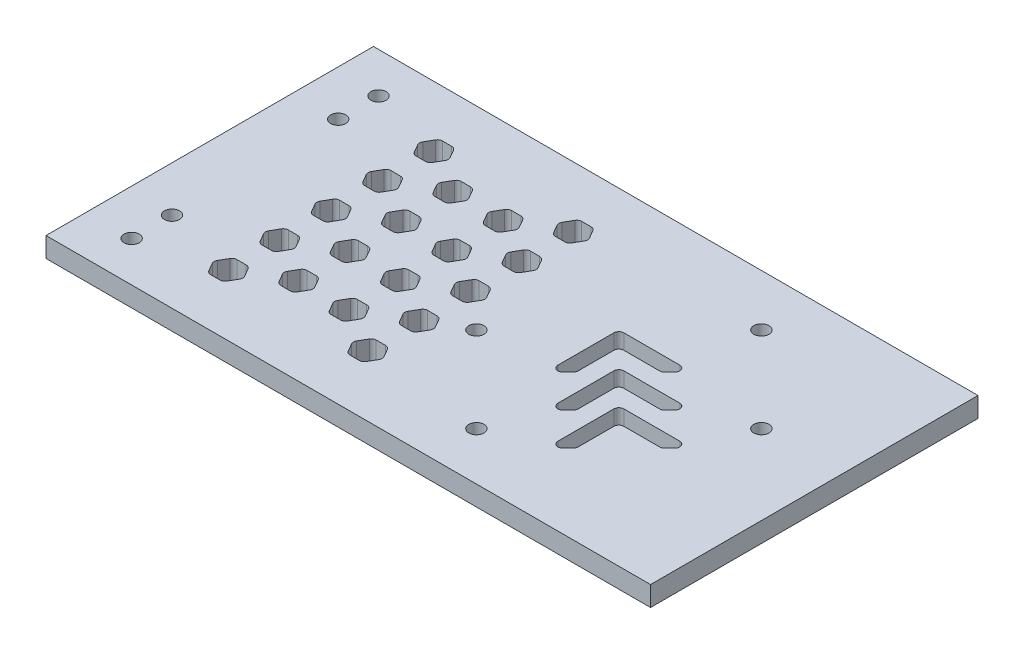
from build123d import *

# Parameters (mm, degrees)
SKETCH_1_W          = 120
SKETCH_1_H          = 65
EXTRUDE_1_DEPTH     = 3.95
SKETCH_4_R          = 1.5
SKETCH_4_R_2        = 1.499999999
CUT_EXTRUDE_1_DEPTH = 4
CUT_EXTRUDE_2_DEPTH = 8
SKETCH_7_R          = 1.5
CUT_EXTRUDE_3_DEPTH = 8
CUT_EXTRUDE_4_DEPTH = 10
FILLET_1_R          = 1


with BuildPart() as part:
    # 草图1 → 凸台-拉伸1 (new body)
    with BuildSketch(Plane(origin=(0, 0, 0), x_dir=(1, 0, 0), z_dir=(0, 1, 0))):
        Rectangle(SKETCH_1_W, SKETCH_1_H)
    extrude(amount=EXTRUDE_1_DEPTH)

    # 草图4 → 切除-拉伸1 (cut)
    with BuildSketch(Plane(origin=(0, 3.95, 0), x_dir=(1, 0, 0), z_dir=(0, 1, 0))):
        with Locations(Location((-1.054245082, -6.016822731, 0), (0, 0, 270))):
            Circle(SKETCH_4_R)
        with Locations(Location((27.230026166, 22.267448517, 0), (0, 0, 270))):
            Circle(SKETCH_4_R)
        with Locations(Location((15.916317667, -22.987385479, 0), (0, 0, 270))):
            Circle(SKETCH_4_R)
        with Locations(Location((44.200588915, 5.296885768, 0), (0, 0, 270))):
            Circle(SKETCH_4_R_2)
    extrude(amount=-CUT_EXTRUDE_1_DEPTH, mode=Mode.SUBTRACT)

    # 草图5 → 切除-拉伸2 (cut)
    with BuildSketch(Plane(origin=(0, 3.95, 0), x_dir=(1, 0, 0), z_dir=(0, 1, 0))):
        Polygon((13.087890542, 8.125312893), (13.087890542, -6.374687107), (16.087890542, -3.374687107), (16.087890542, 5.125312893), (24.587890542, 5.125312893), (27.587890542, 8.125312893), align=None)
        Polygon((34.123424448, 1.589778987), (19.623424448, 1.589778987), (19.623424448, -12.910221013), (22.623424448, -9.910221013), (22.623424448, -1.410221013), (31.123424448, -1.410221013), align=None)
        Polygon((40.658958354, -4.945754919), (26.158958354, -4.945754919), (26.158958354, -19.445754919), (29.158958354, -16.445754919), (29.158958354, -7.945754919), (37.658958354, -7.945754919), align=None)
    extrude(amount=-CUT_EXTRUDE_2_DEPTH, mode=Mode.SUBTRACT)

    # 草图7 → 切除-拉伸3 (cut)
    with BuildSketch(Plane(origin=(0, 3.95, 0), x_dir=(1, 0, 0), z_dir=(0, 1, 0))):
        with Locations(Location((-51, -24.5, 0), (0, 0, 270))):
            Circle(SKETCH_7_R)
        with Locations(Location((-51, -16.5, 0), (0, 0, 270))):
            Circle(SKETCH_7_R)
        with Locations(Location((-51, 24.5, 0), (0, 0, 270))):
            Circle(SKETCH_7_R)
        with Locations(Location((-51, 16.5, 0), (0, 0, 270))):
            Circle(SKETCH_7_R)
    extrude(amount=-CUT_EXTRUDE_3_DEPTH, mode=Mode.SUBTRACT)

    # 草图9 → 切除-拉伸4 (cut)
    with BuildSketch(Plane(origin=(0, 3.95, 0), x_dir=(1, 0, 0), z_dir=(0, 1, 0))):
        Polygon((-34.5, 17.901923789), (-33, 20.5), (-34.5, 23.098076211), (-37.5, 23.098076211), (-39, 20.5), (-37.5, 17.901923789), align=None)
        Polygon((-34.5, 7.705771366), (-33, 10.303847577), (-34.5, 12.901923789), (-37.5, 12.901923789), (-39, 10.303847577), (-37.5, 7.705771366), align=None)
        Polygon((-34.5, -2.490381057), (-33, 0.107695155), (-34.5, 2.705771366), (-37.5, 2.705771366), (-39, 0.107695155), (-37.5, -2.490381057), align=None)
        Polygon((-34.5, -12.686533479), (-33, -10.088457268), (-34.5, -7.490381057), (-37.5, -7.490381057), (-39, -10.088457268), (-37.5, -12.686533479), align=None)
        Polygon((-34.5, -22.882685902), (-33, -20.284609691), (-34.5, -17.686533479), (-37.5, -17.686533479), (-39, -20.284609691), (-37.5, -22.882685902), align=None)
        Polygon((-24.169872981, 15.401923789), (-25.669872981, 18), (-28.669872981, 18), (-30.169872981, 15.401923789), (-28.669872981, 12.803847577), (-25.669872981, 12.803847577), align=None)
        Polygon((-24.169872981, 5.205771366), (-25.669872981, 7.803847577), (-28.669872981, 7.803847577), (-30.169872981, 5.205771366), (-28.669872981, 2.607695155), (-25.669872981, 2.607695155), align=None)
        Polygon((-24.169872981, -4.990381057), (-25.669872981, -2.392304845), (-28.669872981, -2.392304845), (-30.169872981, -4.990381057), (-28.669872981, -7.588457268), (-25.669872981, -7.588457268), align=None)
        Polygon((-24.169872981, -15.186533479), (-25.669872981, -12.588457268), (-28.669872981, -12.588457268), (-30.169872981, -15.186533479), (-28.669872981, -17.784609691), (-25.669872981, -17.784609691), align=None)
        Polygon((-18.669872981, -17.784609691), (-20.169872981, -15.186533479), (-18.669872981, -12.588457268), (-15.669872981, -12.588457268), (-14.169872981, -15.186533479), (-15.669872981, -17.784609691), align=None)
        Polygon((-18.669872981, -7.588457268), (-20.169872981, -4.990381057), (-18.669872981, -2.392304845), (-15.669872981, -2.392304845), (-14.169872981, -4.990381057), (-15.669872981, -7.588457268), align=None)
        Polygon((-18.669872981, 2.607695155), (-20.169872981, 5.205771366), (-18.669872981, 7.803847577), (-15.669872981, 7.803847577), (-14.169872981, 5.205771366), (-15.669872981, 2.607695155), align=None)
        Polygon((-18.669872981, 12.803847577), (-20.169872981, 15.401923789), (-18.669872981, 18), (-15.669872981, 18), (-14.169872981, 15.401923789), (-15.669872981, 12.803847577), align=None)
        Polygon((-6.839745962, -22.882685902), (-9.839745962, -22.882685902), (-11.339745962, -20.284609691), (-9.839745962, -17.686533479), (-6.839745962, -17.686533479), (-5.339745962, -20.284609691), align=None)
        Polygon((-6.839745962, -12.686533479), (-9.839745962, -12.686533479), (-11.339745962, -10.088457268), (-9.839745962, -7.490381057), (-6.839745962, -7.490381057), (-5.339745962, -10.088457268), align=None)
        Polygon((-6.839745962, -2.490381057), (-9.839745962, -2.490381057), (-11.339745962, 0.107695155), (-9.839745962, 2.705771366), (-6.839745962, 2.705771366), (-5.339745962, 0.107695155), align=None)
        Polygon((-6.839745962, 7.705771366), (-9.839745962, 7.705771366), (-11.339745962, 10.303847577), (-9.839745962, 12.901923789), (-6.839745962, 12.901923789), (-5.339745962, 10.303847577), align=None)
        Polygon((-6.839745962, 17.901923789), (-9.839745962, 17.901923789), (-11.339745962, 20.5), (-9.839745962, 23.098076211), (-6.839745962, 23.098076211), (-5.339745962, 20.5), align=None)
    extrude(amount=-CUT_EXTRUDE_4_DEPTH, mode=Mode.SUBTRACT)

    # 圆角1
    fillet_1_edges = [part.edges().sort_by_distance(p)[0] for p in [
        (-34.5, 1.975, -7.705771366),
        (-37.5, 1.975, -7.705771366),
        (-39, 1.975, -10.303847577),
        (-37.5, 1.975, -12.901923789),
        (-34.5, 1.975, -12.901923789),
        (-33, 1.975, -10.303847577),
        (-34.5, 1.975, 2.490381057),
        (-37.5, 1.975, 2.490381057),
        (-39, 1.975, -0.107695155),
        (-37.5, 1.975, -2.705771366),
        (-34.5, 1.975, -2.705771366),
        (-33, 1.975, -0.107695155),
        (-34.5, 1.975, 12.686533479),
        (-37.5, 1.975, 12.686533479),
        (-39, 1.975, 10.088457268),
        (-37.5, 1.975, 7.490381057),
        (-34.5, 1.975, 7.490381057),
        (-33, 1.975, 10.088457268),
        (-34.5, 1.975, 22.882685902),
        (-37.5, 1.975, 22.882685902),
        (-39, 1.975, 20.284609691),
        (-37.5, 1.975, 17.686533479),
        (-34.5, 1.975, 17.686533479),
        (-33, 1.975, 20.284609691),
        (-24.169872981, 1.975, -15.401923789),
        (-25.669872981, 1.975, -12.803847577),
        (-28.669872981, 1.975, -12.803847577),
        (-30.169872981, 1.975, -15.401923789),
        (-28.669872981, 1.975, -18),
        (-25.669872981, 1.975, -18),
        (-24.169872981, 1.975, -5.205771366),
        (-25.669872981, 1.975, -2.607695155),
        (-28.669872981, 1.975, -2.607695155),
        (-30.169872981, 1.975, -5.205771366),
        (-28.669872981, 1.975, -7.803847577),
        (-25.669872981, 1.975, -7.803847577),
        (-24.169872981, 1.975, 4.990381057),
        (-25.669872981, 1.975, 7.588457268),
        (-28.669872981, 1.975, 7.588457268),
        (-30.169872981, 1.975, 4.990381057),
        (-28.669872981, 1.975, 2.392304845),
        (-25.669872981, 1.975, 2.392304845),
        (-24.169872981, 1.975, 15.186533479),
        (-25.669872981, 1.975, 17.784609691),
        (-28.669872981, 1.975, 17.784609691),
        (-30.169872981, 1.975, 15.186533479),
        (-28.669872981, 1.975, 12.588457268),
        (-25.669872981, 1.975, 12.588457268),
        (-15.669872981, 1.975, 17.784609691),
        (-18.669872981, 1.975, 17.784609691),
        (-20.169872981, 1.975, 15.186533479),
        (-18.669872981, 1.975, 12.588457268),
        (-15.669872981, 1.975, 12.588457268),
        (-14.169872981, 1.975, 15.186533479),
        (-15.669872981, 1.975, 7.588457268),
        (-18.669872981, 1.975, 7.588457268),
        (-20.169872981, 1.975, 4.990381057),
        (-18.669872981, 1.975, 2.392304845),
        (-15.669872981, 1.975, 2.392304845),
        (-14.169872981, 1.975, 4.990381057),
        (-15.669872981, 1.975, -2.607695155),
        (-18.669872981, 1.975, -2.607695155),
        (-20.169872981, 1.975, -5.205771366),
        (-18.669872981, 1.975, -7.803847577),
        (-15.669872981, 1.975, -7.803847577),
        (-14.169872981, 1.975, -5.205771366),
        (-15.669872981, 1.975, -12.803847577),
        (-18.669872981, 1.975, -12.803847577),
        (-20.169872981, 1.975, -15.401923789),
        (-18.669872981, 1.975, -18),
        (-15.669872981, 1.975, -18),
        (-14.169872981, 1.975, -15.401923789),
        (-5.339745962, 1.975, 20.284609691),
        (-6.839745962, 1.975, 22.882685902),
        (-9.839745962, 1.975, 22.882685902),
        (-11.339745962, 1.975, 20.284609691),
        (-9.839745962, 1.975, 17.686533479),
        (-6.839745962, 1.975, 17.686533479),
        (-5.339745962, 1.975, 10.088457268),
        (-6.839745962, 1.975, 12.686533479),
        (-9.839745962, 1.975, 12.686533479),
        (-11.339745962, 1.975, 10.088457268),
        (-9.839745962, 1.975, 7.490381057),
        (-6.839745962, 1.975, 7.490381057),
        (-5.339745962, 1.975, -0.107695155),
        (-6.839745962, 1.975, 2.490381057),
        (-9.839745962, 1.975, 2.490381057),
        (-11.339745962, 1.975, -0.107695155),
        (-9.839745962, 1.975, -2.705771366),
        (-6.839745962, 1.975, -2.705771366),
        (-5.339745962, 1.975, -10.303847577),
        (-6.839745962, 1.975, -7.705771366),
        (-9.839745962, 1.975, -7.705771366),
        (-11.339745962, 1.975, -10.303847577),
        (-9.839745962, 1.975, -12.901923789),
        (-6.839745962, 1.975, -12.901923789),
        (-5.339745962, 1.975, -20.5),
        (-6.839745962, 1.975, -17.901923789),
        (-9.839745962, 1.975, -17.901923789),
        (-11.339745962, 1.975, -20.5),
        (-9.839745962, 1.975, -23.098076211),
        (-6.839745962, 1.975, -23.098076211),
        (-34.5, 1.975, -17.901923789),
        (-37.5, 1.975, -17.901923789),
        (-39, 1.975, -20.5),
        (-37.5, 1.975, -23.098076211),
        (-34.5, 1.975, -23.098076211),
        (-33, 1.975, -20.5),
        (19.623424448, 1.975, 12.910221013),
        (19.623424448, 1.975, -1.589778987),
        (34.123424448, 1.975, -1.589778987),
        (31.123424448, 1.975, 1.410221013),
        (22.623424448, 1.975, 1.410221013),
        (22.623424448, 1.975, 9.910221013),
        (26.158958354, 1.975, 19.445754919),
        (26.158958354, 1.975, 4.945754919),
        (40.658958354, 1.975, 4.945754919),
        (37.658958354, 1.975, 7.945754919),
        (29.158958354, 1.975, 7.945754919),
        (29.158958354, 1.975, 16.445754919),
        (13.087890542, 1.975, -8.125312893),
        (27.587890542, 1.975, -8.125312893),
        (24.587890542, 1.975, -5.125312893),
        (16.087890542, 1.975, -5.125312893),
        (16.087890542, 1.975, 3.374687107),
        (13.087890542, 1.975, 6.374687107),
    ]]
    fillet(fillet_1_edges, radius=FILLET_1_R)


solid = part.part
